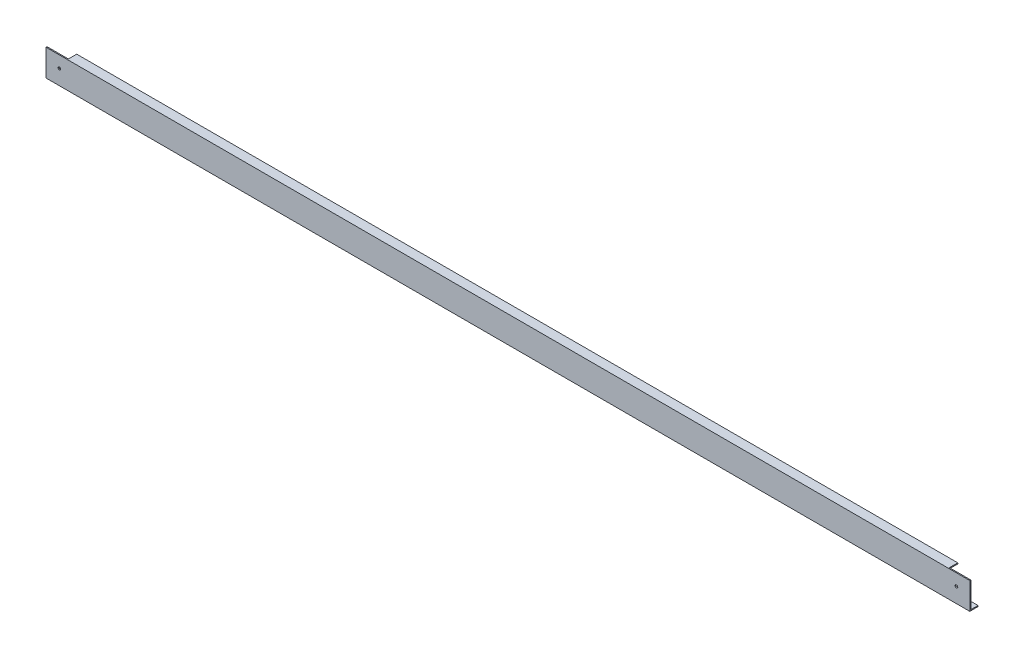
from build123d import *

# Parameters (mm, degrees)
BOSS_EXTRUDE1_DEPTH = 4394.2
CUT_EXTRUDE1_REACH  = 4398.213
SKETCH2_R           = 6.35
CUT_EXTRUDE4_REACH  = 4398.213
SKETCH3_W           = 101.6
SKETCH3_H           = 4.826


with BuildPart() as part:
    # Sketch1 → Boss-Extrude1 (new body)
    with BuildSketch(Plane(origin=(0, 0, 0), x_dir=(0, 0, -1), z_dir=(1, 0, 0))):
        Polygon((0, 0), (0, 127), (44.45, 127), (44.45, 122.174), (4.826, 122.174), (4.826, 4.826), (39.050693766, 4.826), (39.050693766, 0), align=None)
    extrude(amount=BOSS_EXTRUDE1_DEPTH)

    # Sketch2 → Cut-Extrude1 (cut, up to next)
    with BuildSketch(Plane(origin=(0, 0, -4.826), x_dir=(-1, 0, 0), z_dir=(0, 0, -1)), mode=Mode.PRIVATE) as cut_extrude1_sk1:
        with Locations((-4330.7, 71.12)):
            Circle(SKETCH2_R)
    cut_extrude1_tool1 = extrude(cut_extrude1_sk1.sketch, amount=-CUT_EXTRUDE1_REACH, mode=Mode.PRIVATE) & part.part
    # Sketch2 → Cut-Extrude1 (cut, up to next)
    with BuildSketch(Plane(origin=(0, 0, -4.826), x_dir=(-1, 0, 0), z_dir=(0, 0, -1)), mode=Mode.PRIVATE) as cut_extrude1_sk2:
        with Locations((-63.5, 71.12)):
            Circle(SKETCH2_R)
    cut_extrude1_tool2 = extrude(cut_extrude1_sk2.sketch, amount=-CUT_EXTRUDE1_REACH, mode=Mode.PRIVATE) & part.part
    add(cut_extrude1_tool1.solids().sort_by_distance((4330.7, 71.12, -4.826))[0], mode=Mode.SUBTRACT)
    add(cut_extrude1_tool2.solids().sort_by_distance((63.5, 71.12, -4.826))[0], mode=Mode.SUBTRACT)

    # Sketch3 → Cut-Extrude4 (cut, up to next)
    with BuildSketch(Plane(origin=(0, 0, -4.826), x_dir=(-1, 0, 0), z_dir=(0, 0, -1)), mode=Mode.PRIVATE) as cut_extrude4_sk1:
        with Locations((-4343.4, 124.587)):
            Rectangle(SKETCH3_W, SKETCH3_H)
    cut_extrude4_tool1 = extrude(cut_extrude4_sk1.sketch, amount=CUT_EXTRUDE4_REACH, mode=Mode.PRIVATE) & part.part
    # Sketch3 → Cut-Extrude4 (cut, up to next)
    with BuildSketch(Plane(origin=(0, 0, -4.826), x_dir=(-1, 0, 0), z_dir=(0, 0, -1)), mode=Mode.PRIVATE) as cut_extrude4_sk2:
        with Locations((-50.8, 124.587)):
            Rectangle(SKETCH3_W, SKETCH3_H)
    cut_extrude4_tool2 = extrude(cut_extrude4_sk2.sketch, amount=CUT_EXTRUDE4_REACH, mode=Mode.PRIVATE) & part.part
    add(cut_extrude4_tool1.solids().sort_by_distance((4343.4, 124.587, -4.826))[0], mode=Mode.SUBTRACT)
    add(cut_extrude4_tool2.solids().sort_by_distance((50.8, 124.587, -4.826))[0], mode=Mode.SUBTRACT)


solid = part.part
